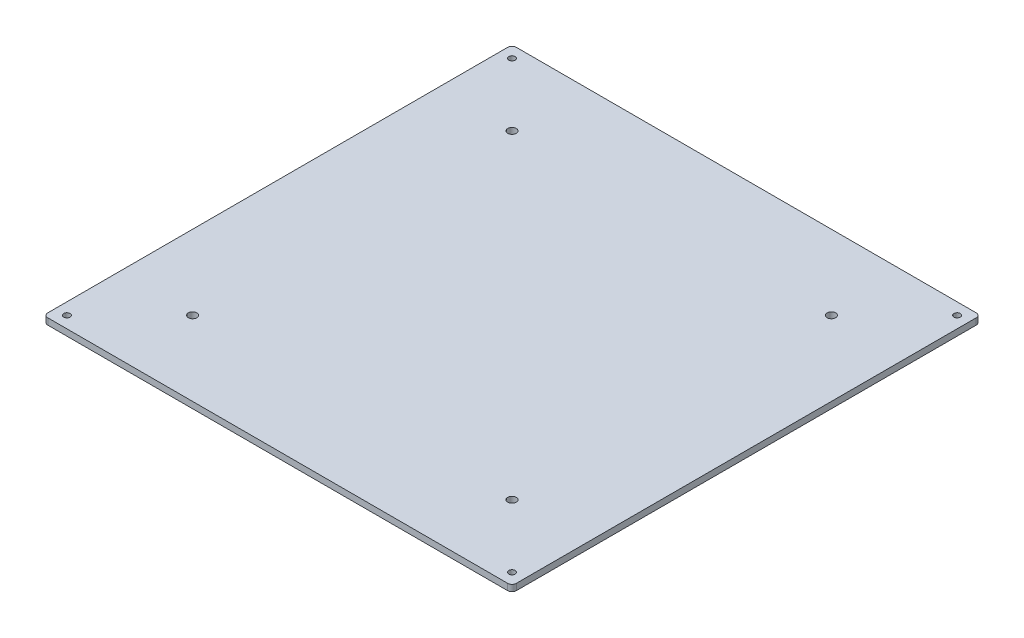
from build123d import *

# Parameters (mm, degrees)
SKETCH1_W           = 220
SKETCH1_H           = 220
BOSS_EXTRUDE1_DEPTH = 3
SKETCH3_R           = 2
SKETCH3_R_2         = 1.5
CUT_EXTRUDE1_DEPTH  = 10
FILLET1_R           = 2


with BuildPart() as part:
    # Sketch1 → Boss-Extrude1 (new body)
    with BuildSketch(Plane(origin=(0, 0, 0), x_dir=(1, 0, 0), z_dir=(0, 1, 0))):
        Rectangle(SKETCH1_W, SKETCH1_H)
    extrude(amount=BOSS_EXTRUDE1_DEPTH)

    # Sketch3 → Cut-Extrude1 (cut)
    with BuildSketch(Plane(origin=(0, 3, 0), x_dir=(1, 0, 0), z_dir=(0, 1, 0))):
        with Locations(Location((-75, 75, 0), (0, 0, 270))):
            Circle(SKETCH3_R)
        with Locations(Location((75, 75, 0), (0, 0, 270))):
            Circle(SKETCH3_R)
        with Locations(Location((75, -75, 0), (0, 0, 270))):
            Circle(SKETCH3_R)
        with Locations(Location((-75, -75, 0), (0, 0, 270))):
            Circle(SKETCH3_R)
        with Locations(Location((-104.5, 104.5, 0), (0, 0, 270))):
            Circle(SKETCH3_R_2)
        with Locations(Location((104.5, 104.5, 0), (0, 0, 270))):
            Circle(SKETCH3_R_2)
        with Locations(Location((104.5, -104.5, 0), (0, 0, 270))):
            Circle(SKETCH3_R_2)
        with Locations(Location((-104.5, -104.5, 0), (0, 0, 270))):
            Circle(SKETCH3_R_2)
    extrude(amount=-CUT_EXTRUDE1_DEPTH, mode=Mode.SUBTRACT)

    # Fillet1
    fillet1_edges = [part.edges().sort_by_distance(p)[0] for p in [
        (-110, 1.5, -110),
        (110, 1.5, -110),
        (110, 1.5, 110),
        (-110, 1.5, 110),
    ]]
    fillet(fillet1_edges, radius=FILLET1_R)


solid = part.part
